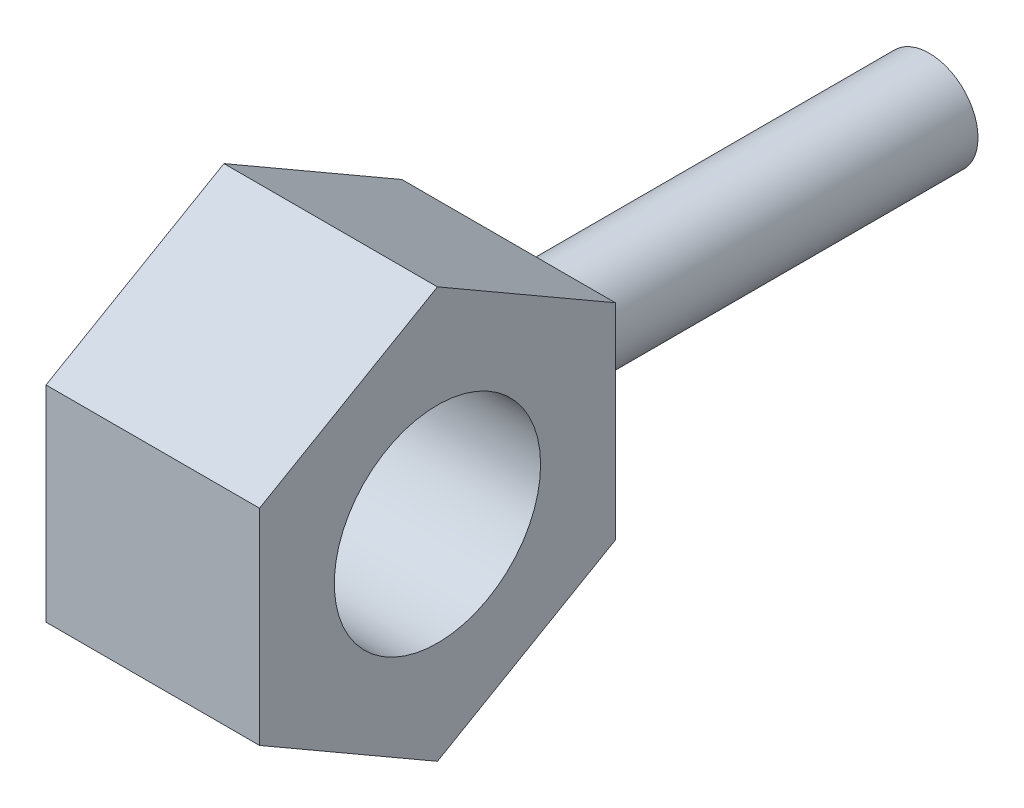
from build123d import *

# Parameters (mm, degrees)
CROQUIS1_R              = 14.493410581
SALIENTE_EXTRUIR1_DEPTH = 30
CROQUIS2_R              = 6.849720654
SALIENTE_EXTRUIR2_DEPTH = 60


with BuildPart() as part:
    # Croquis1 → Saliente-Extruir1 (new body)
    with BuildSketch(Plane(origin=(0, 0, 0), x_dir=(0, 0, -1), z_dir=(1, 0, 0))):
        Polygon((25, 14.43375673), (0, 28.867513459), (-25, 14.43375673), (-25, -14.43375673), (0, -28.867513459), (25, -14.43375673), align=None)
        Circle(CROQUIS1_R, mode=Mode.SUBTRACT)
    extrude(amount=SALIENTE_EXTRUIR1_DEPTH)

    # Croquis2 → Saliente-Extruir2 (add)
    with BuildSketch(Plane(origin=(0, 0, -25), x_dir=(-1, 0, 0), z_dir=(0, 0, -1))):
        with Locations(Location((-14.099346636, 0, 0), (0, 0, 180))):
            Circle(CROQUIS2_R)
    extrude(amount=SALIENTE_EXTRUIR2_DEPTH)


solid = part.part
